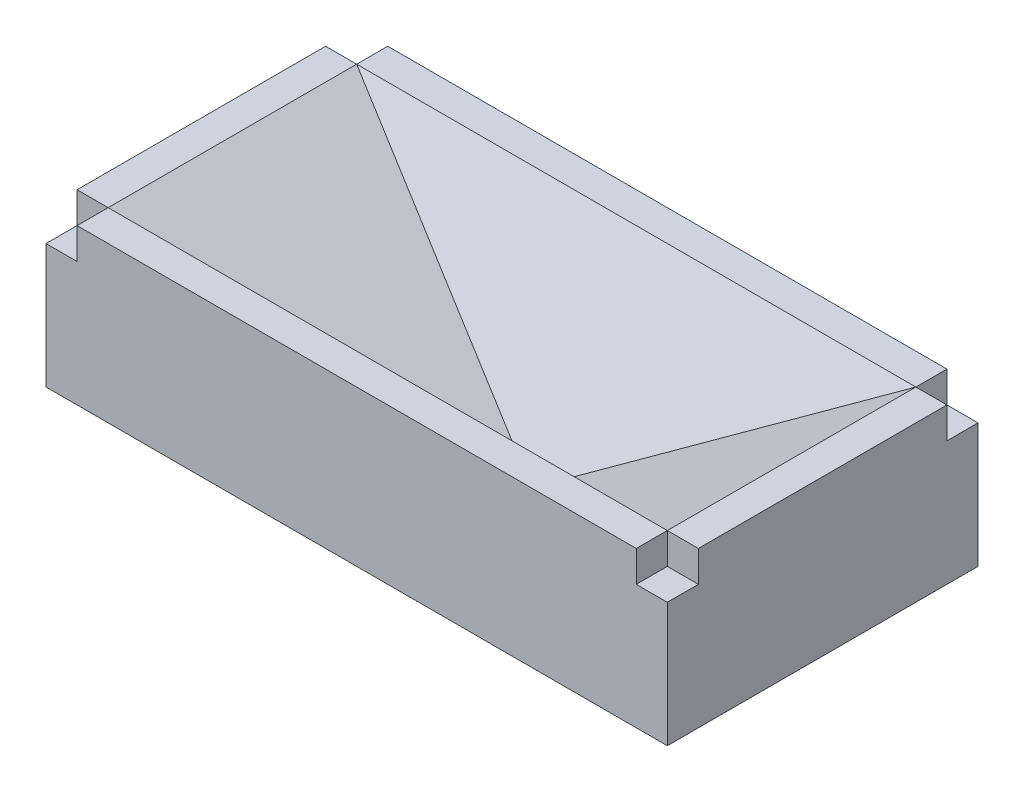
from build123d import *

# Parameters (mm, degrees)
SKETCH2_W           = 100
SKETCH2_H           = 50
BOSS_EXTRUDE1_DEPTH = 25
CUT_EXTRUDE1_DEPTH  = 9
CUT_EXTRUDE2_DEPTH  = 6.4
SKETCH8_W           = 6
SKETCH8_H           = 6
CUT_EXTRUDE3_DEPTH  = 6
SKETCH9_W           = 5
SKETCH9_H           = 5
CUT_EXTRUDE4_DEPTH  = 5


with BuildPart() as part:
    # Sketch2 → Boss-Extrude1 (new body)
    with BuildSketch(Plane(origin=(0, 0, 0), x_dir=(1, 0, 0), z_dir=(0, 1, 0))):
        Rectangle(SKETCH2_W, SKETCH2_H)
    extrude(amount=-BOSS_EXTRUDE1_DEPTH)

    # Sketch3 → Cut-Loft4 section 0
    with BuildSketch(Plane(origin=(0, 0, 0), x_dir=(1, 0, 0), z_dir=(0, 1, 0))):
        with BuildLine():
            Line((-45, 20), (45, 20))
            Line((45, 20), (45, -20))
            Line((45, -20), (-45, -20))
            Line((-45, -20), (-45, 20))
        make_face()
    # Sketch4 → Cut-Loft4 section 1
    with BuildSketch(Plane.XZ.offset(25)):
        with BuildLine():
            Line((-5, 5), (5, 5))
            Line((5, 5), (5, -5))
            Line((5, -5), (-5, -5))
            Line((-5, -5), (-5, 5))
        make_face()
    loft(mode=Mode.SUBTRACT)

    # Sketch5 → Cut-Extrude1 (cut)
    with BuildSketch(Plane(origin=(0, 0, -25), x_dir=(-1, 0, 0), z_dir=(0, 0, -1))):
        Polygon((0, -8), (3.2, -8), (3.2, -25), (-3.2, -25), (-3.2, -8), align=None)
    extrude(amount=-CUT_EXTRUDE1_DEPTH, mode=Mode.SUBTRACT)

    # Sketch6 → Cut-Extrude2 (cut)
    with BuildSketch(Plane(origin=(-3.2, 0, 0), x_dir=(0, 0, -1), z_dir=(1, 0, 0))):
        Polygon((16, -25), (5.785369477, -25), (16, -8), align=None)
    extrude(amount=CUT_EXTRUDE2_DEPTH, mode=Mode.SUBTRACT)

    # Sketch8 → Cut-Extrude3 (cut)
    with BuildSketch(Plane.XZ.offset(25)):
        with Locations((-45, 20)):
            Rectangle(SKETCH8_W, SKETCH8_H)
        with Locations((45, 20)):
            Rectangle(SKETCH8_W, SKETCH8_H)
    extrude(amount=-CUT_EXTRUDE3_DEPTH, mode=Mode.SUBTRACT)

    # Sketch9 → Cut-Extrude4 (cut)
    with BuildSketch(Plane(origin=(0, 0, 0), x_dir=(1, 0, 0), z_dir=(0, 1, 0))):
        with Locations((47.5, -22.5)):
            Rectangle(SKETCH9_W, SKETCH9_H)
        with Locations((-47.5, -22.5)):
            Rectangle(SKETCH9_W, SKETCH9_H)
        with Locations((-47.5, 22.5)):
            Rectangle(SKETCH9_W, SKETCH9_H)
        with Locations((47.5, 22.5)):
            Rectangle(SKETCH9_W, SKETCH9_H)
    extrude(amount=-CUT_EXTRUDE4_DEPTH, mode=Mode.SUBTRACT)


solid = part.part
